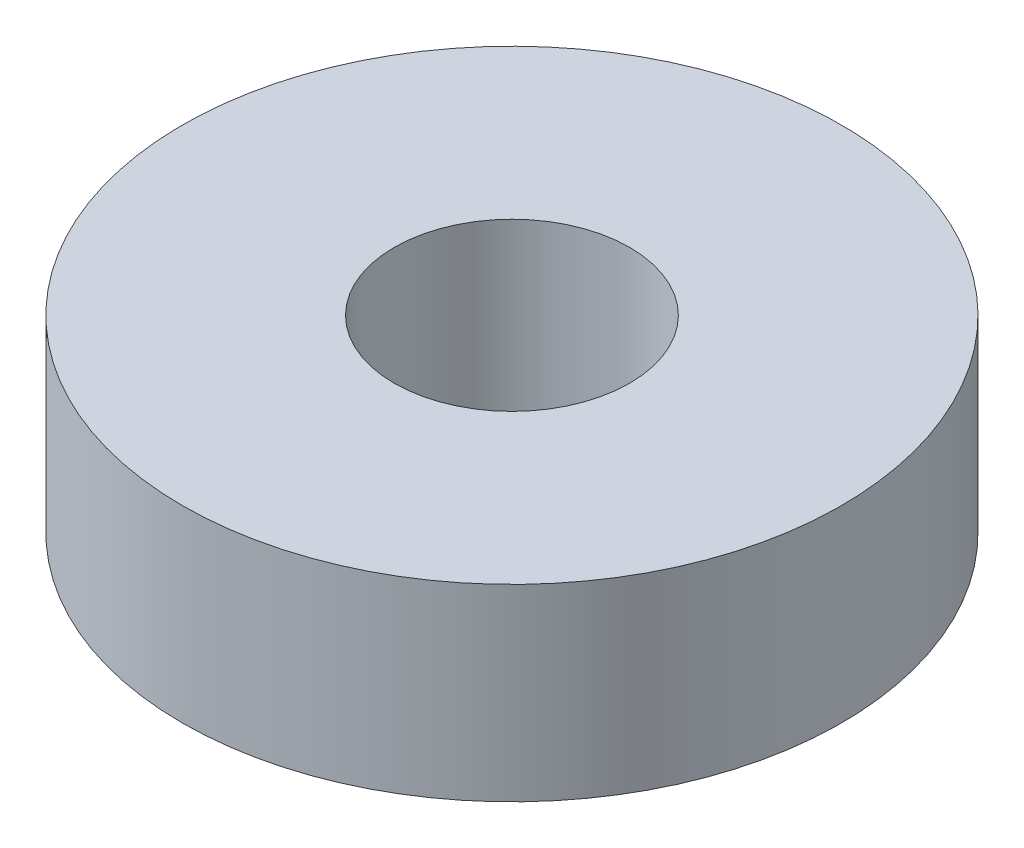
from build123d import *

# Parameters (mm, degrees)
CROQUIS1_R              = 14
CROQUIS1_R_2            = 5
SALIENTE_EXTRUIR1_DEPTH = 8


with BuildPart() as part:
    # Croquis1 → Saliente-Extruir1 (new body)
    with BuildSketch(Plane(origin=(0, 0, 0), x_dir=(1, 0, 0), z_dir=(0, 1, 0))):
        with Locations(Location((0, 0, 0), (0, 0, 270))):
            Circle(CROQUIS1_R)
        with Locations(Location((0, 0, 0), (0, 0, 270))):
            Circle(CROQUIS1_R_2, mode=Mode.SUBTRACT)
    extrude(amount=SALIENTE_EXTRUIR1_DEPTH)


solid = part.part
